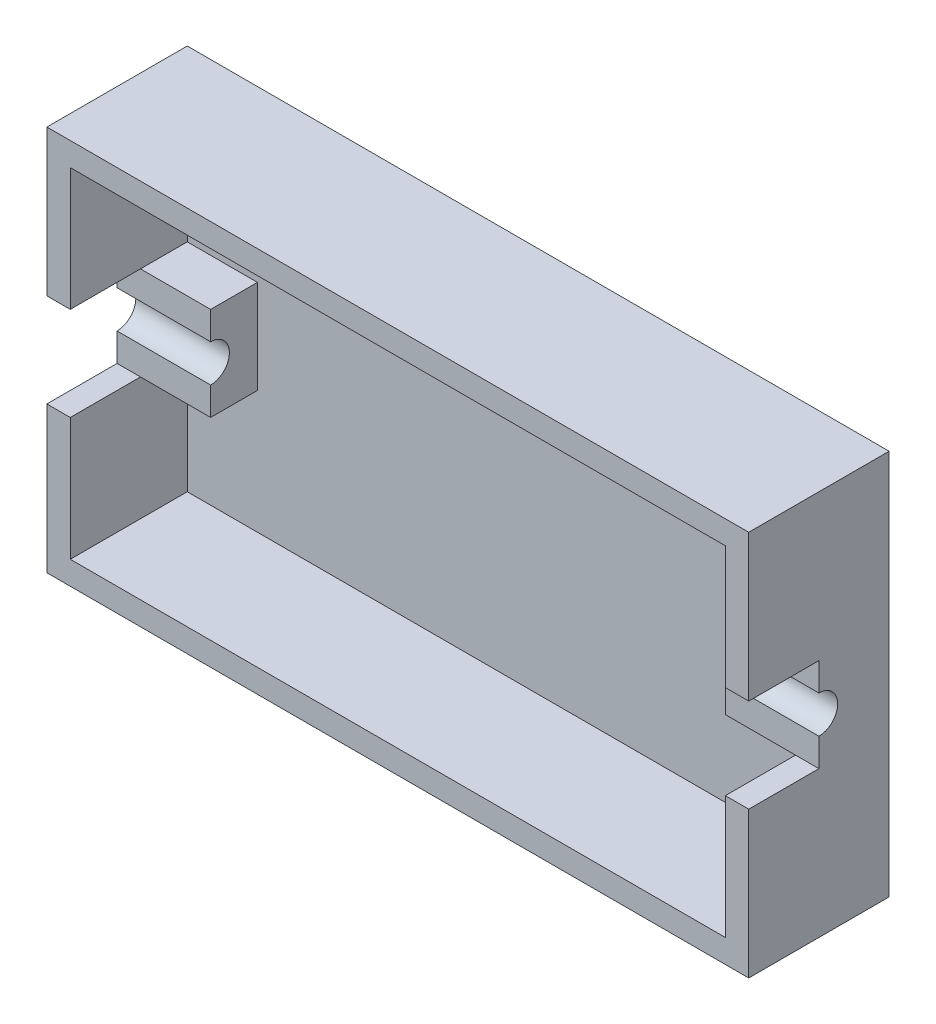
from build123d import *

# Parameters (mm, degrees)
SKETCH_1_W          = 300
SKETCH_1_H          = 165
EXTRUDE_1_DEPTH     = 10
SKETCH_2_W          = 40
SKETCH_2_H          = 40
EXTRUDE_2_DEPTH     = 20
EXTRUDE_3_DEPTH     = 50
SKETCH_5_R          = 8
CUT_EXTRUDE_1_DEPTH = 348.598906788


with BuildPart() as part:
    # 스케치1 → 보스-돌출1 (new body)
    with BuildSketch(Plane.XY):
        with Locations((150, 82.5)):
            Rectangle(SKETCH_1_W, SKETCH_1_H)
    extrude(amount=EXTRUDE_1_DEPTH)

    # 스케치2 → 보스-돌출2 (add)
    with BuildSketch(Plane.XY.offset(10)):
        with Locations((20, 82.5)):
            Rectangle(SKETCH_2_W, SKETCH_2_H)
        with Locations((280, 82.5)):
            Rectangle(SKETCH_2_W, SKETCH_2_H)
    extrude(amount=EXTRUDE_2_DEPTH)

    # 스케치4 → 보스-돌출3 (add)
    with BuildSketch(Plane.XY.offset(10)):
        Polygon((0, 165), (0, 102.5), (10, 102.5), (10, 155), (290, 155), (290, 102.5), (300, 102.5), (300, 165), align=None)
        Polygon((10, 62.5), (0, 62.5), (0, 0), (300, 0), (300, 62.5), (290, 62.5), (290, 10), (10, 10), align=None)
    extrude(amount=EXTRUDE_3_DEPTH)

    # 스케치5 → 컷-돌출1 (cut, through all)
    with BuildSketch(Plane(origin=(300, 0, 0), x_dir=(0, 0, -1), z_dir=(1, 0, 0))):
        with Locations((-30, 82.5)):
            Circle(SKETCH_5_R)
    extrude(amount=-CUT_EXTRUDE_1_DEPTH, mode=Mode.SUBTRACT)


solid = part.part
